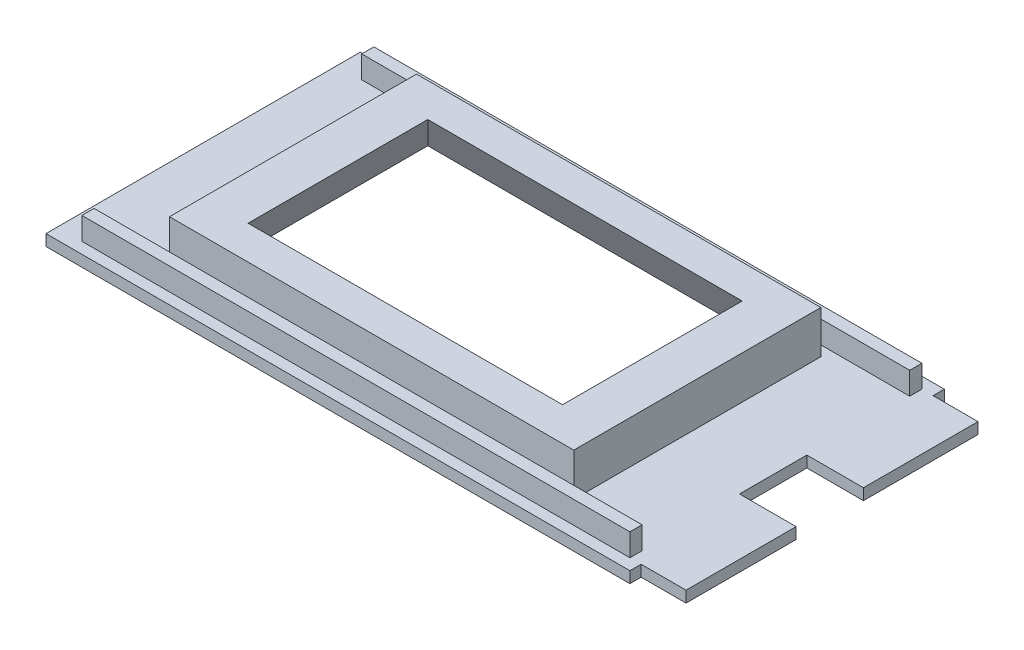
from build123d import *

# Parameters (mm, degrees)
SKETCH1_W           = 165.1
SKETCH1_H           = 88.9
BOSS_EXTRUDE1_DEPTH = 3.175
SKETCH3_W           = 82.55
SKETCH3_H           = 3.175
BOSS_EXTRUDE3_DEPTH = 12.7
SKETCH6_W           = 19.05
SKETCH6_H           = 3.175
CUT_EXTRUDE1_DEPTH  = 16.002
SKETCH8_W           = 154.94
SKETCH8_H           = 3.437080139
BOSS_EXTRUDE4_DEPTH = 6.35
SKETCH9_W           = 114.3
SKETCH9_H           = 69.85
BOSS_EXTRUDE5_DEPTH = 15.24
SKETCH12_W          = 88.9
SKETCH12_H          = 50.8
CUT_EXTRUDE2_DEPTH  = 15.24
CUT_EXTRUDE2_DRAFT  = 30


with BuildPart() as part:
    # Sketch1 → Boss-Extrude1 (new body)
    with BuildSketch(Plane(origin=(0, 0, 0), x_dir=(1, 0, 0), z_dir=(0, 1, 0))):
        Rectangle(SKETCH1_W, SKETCH1_H)
    extrude(amount=BOSS_EXTRUDE1_DEPTH)

    # Sketch3 → Boss-Extrude3 (add)
    with BuildSketch(Plane(origin=(82.55, 0, 0), x_dir=(0, 0, -1), z_dir=(1, 0, 0))):
        with Locations((0, 1.5875)):
            Rectangle(SKETCH3_W, SKETCH3_H)
    extrude(amount=BOSS_EXTRUDE3_DEPTH)

    # Sketch6 → Cut-Extrude1 (cut)
    with BuildSketch(Plane(origin=(95.25, 0, 0), x_dir=(0, 0, -1), z_dir=(1, 0, 0))):
        with Locations((-0.635, 1.5875)):
            Rectangle(SKETCH6_W, SKETCH6_H)
    extrude(amount=-CUT_EXTRUDE1_DEPTH, mode=Mode.SUBTRACT)

    # Sketch8 → Boss-Extrude4 (add)
    with BuildSketch(Plane(origin=(0, 3.175, 0), x_dir=(1, 0, 0), z_dir=(0, 1, 0))):
        with Locations((1.905, -39.556459931)):
            Rectangle(SKETCH8_W, SKETCH8_H)
        with Locations((1.905, 39.556459931)):
            Rectangle(SKETCH8_W, SKETCH8_H)
    extrude(amount=BOSS_EXTRUDE4_DEPTH)

    # Sketch9 → Boss-Extrude5 (add)
    with BuildSketch(Plane(origin=(0, 0, 0), x_dir=(1, 0, 0), z_dir=(0, 1, 0))):
        Rectangle(SKETCH9_W, SKETCH9_H)
    extrude(amount=BOSS_EXTRUDE5_DEPTH)


with BuildPart() as cut_extrude2_tool:
    # Sketch12 → Cut-Extrude2 (with draft: the straight prism first)
    with BuildSketch(Plane(origin=(0, 15.24, 0), x_dir=(1, 0, 0), z_dir=(0, 1, 0))):
        Rectangle(SKETCH12_W, SKETCH12_H)
    extrude(amount=-CUT_EXTRUDE2_DEPTH)
    # Cut-Extrude2: the draft: its side faces are tilted about the plane it starts from
    cut_extrude2_sides = [cut_extrude2_tool.faces().sort_by_distance(p)[0] for p in [
        (-44.45, 7.62, 0),
        (0, 7.62, 25.4),
        (44.45, 7.62, 0),
        (0, 7.62, -25.4),
    ]]
    draft(cut_extrude2_sides, Plane(origin=(0, 15.24, 0), x_dir=(1, 0, 0), z_dir=(0, 1, 0)), CUT_EXTRUDE2_DRAFT)


with BuildPart() as part_1:
    add(part.part)

    # Cut-Extrude2: cut by cut_extrude2_tool
    add(cut_extrude2_tool.part, mode=Mode.SUBTRACT)


solid = part_1.part
